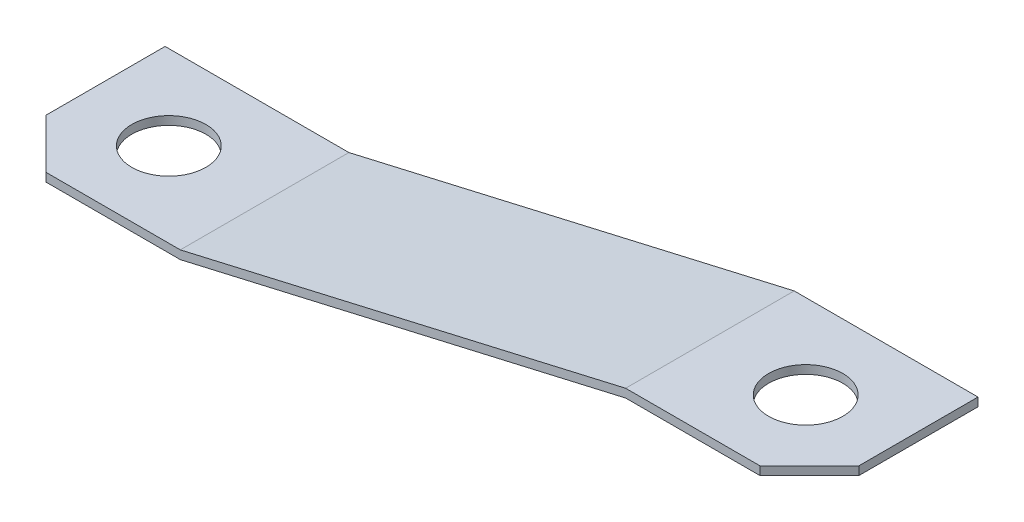
from build123d import *

# Parameters (mm, degrees)
RESSALTO_EXTRUS_O1_DEPTH   = 23.85
CHANFRO1_SIZE              = 7
CORTE_EXTRUS_O1_DEPTH      = 65.048254304
CORTE_EXTRUS_O1_DEPTH_BACK = 65.048254304
ESBO_O2_R                  = 5.25


with BuildPart() as part:
    # Esboço1 → Ressalto-extrusão1 (new body)
    with BuildSketch(Plane.XY):
        Polygon((-57.364870118, 0), (-31.364870118, 0), (31.635129882, 14.544696041), (57.635129882, 14.544696041), (57.635129882, 13.344696041), (31.635129882, 13.344696041), (-31.364870118, -1.2), (-57.364870118, -1.2), align=None)
    extrude(amount=RESSALTO_EXTRUS_O1_DEPTH)

    # Chanfro1
    chanfro1_edges = [part.edges().sort_by_distance(p)[0] for p in [
        (57.635129882, 13.944696041, 23.85),
        (-57.364870118, -0.6, 23.85),
    ]]
    chamfer(chanfro1_edges, length=CHANFRO1_SIZE)

    # Esboço2 → Corte-extrusão1 (cut, two sides: drawn at the far end of the back side and taken through both)
    with BuildSketch(Plane(origin=(0, 0, 0), x_dir=(1, 0, 0), z_dir=(0, 1, 0)).offset(-CORTE_EXTRUS_O1_DEPTH_BACK)):
        with Locations(Location((-44.914870118, -11.925, 0), (0, 0, 270))):
            Circle(ESBO_O2_R)
        with Locations(Location((45.185129882, -11.925, 0), (0, 0, 180))):
            Circle(ESBO_O2_R)
    extrude(amount=CORTE_EXTRUS_O1_DEPTH + CORTE_EXTRUS_O1_DEPTH_BACK, mode=Mode.SUBTRACT)


solid = part.part
